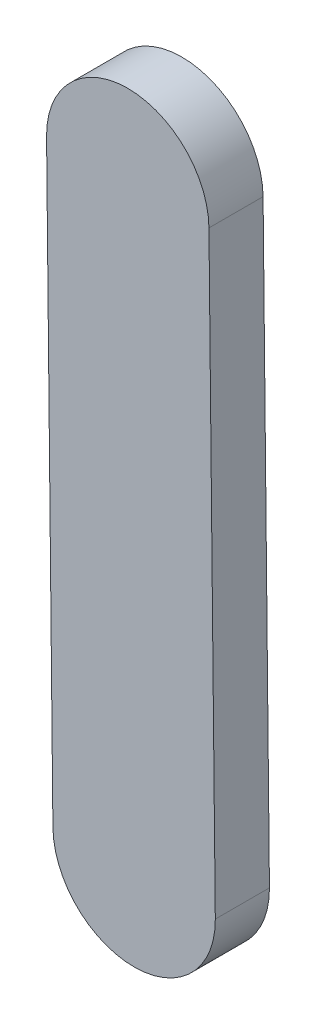
from build123d import *

# Parameters (mm, degrees)
EXTRUDE_2_DEPTH = 1


with BuildPart() as part:
    # 草图1 → 凸台-拉伸2 (new body)
    with BuildSketch(Plane.XY):
        with BuildLine():
            Line((-47.079597586, 77.590626898), (-46.962166555, 66.591253736))
            ThreePointArc((-46.962166555, 66.591253736), (-48.446067755, 65.075325891), (-49.9619956, 66.559227091))
            Line((-49.9619956, 66.559227091), (-50.07942663, 77.558600253))
            ThreePointArc((-50.07942663, 77.558600253), (-48.59552543, 79.074528097), (-47.079597586, 77.590626898))
        make_face()
    extrude(amount=EXTRUDE_2_DEPTH)


solid = part.part
